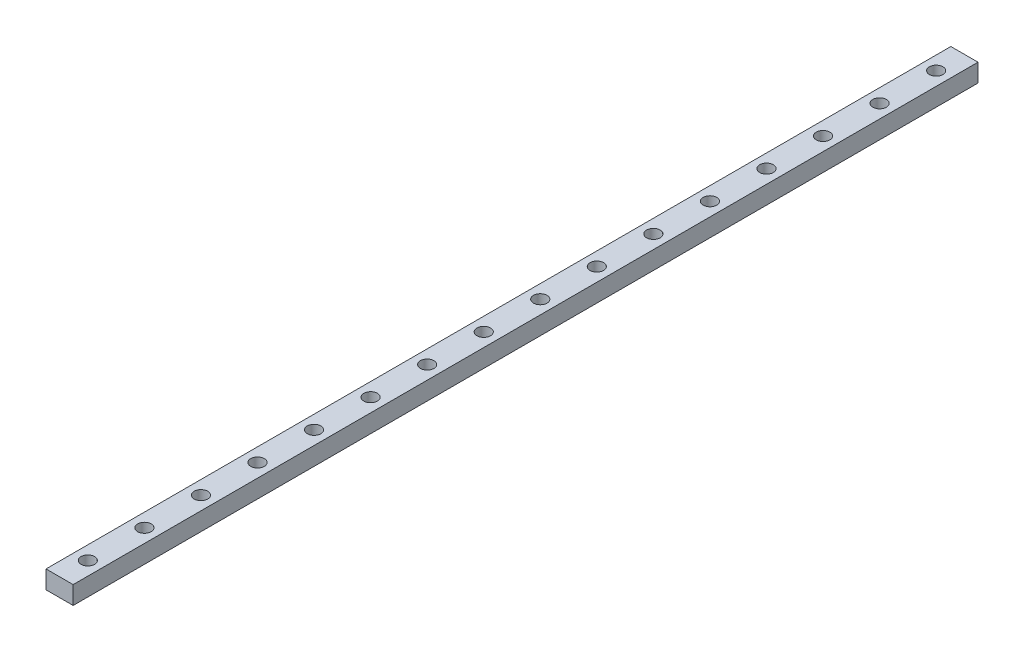
from build123d import *

# Parameters (mm, degrees)
SKETCH1_W           = 12
SKETCH1_H           = 8
BOSS_EXTRUDE1_DEPTH = 400
SKETCH2_R           = 3
CUT_EXTRUDE1_DEPTH  = 4.5
SKETCH4_R           = 1.75
CUT_EXTRUDE2_DEPTH  = 401.259915555
LPATTERN2_COUNT     = 16
LPATTERN2_PITCH     = 25


with BuildPart() as part:
    # Sketch1 → Boss-Extrude1 (new body)
    with BuildSketch(Plane.XY):
        with Locations((6, 4)):
            Rectangle(SKETCH1_W, SKETCH1_H)
    extrude(amount=BOSS_EXTRUDE1_DEPTH)

    # Sketch2 → Cut-Extrude1 (cut)
    with BuildSketch(Plane(origin=(0, 8, 0), x_dir=(1, 0, 0), z_dir=(0, 1, 0))):
        with Locations(Location((6, -12.5, 0), (0, 0, 270))):
            Circle(SKETCH2_R)
    cut_extrude1 = extrude(amount=-CUT_EXTRUDE1_DEPTH, mode=Mode.SUBTRACT)

    # Sketch4 → Cut-Extrude2 (cut, through all)
    with BuildSketch(Plane.XZ):
        with Locations(Location((6, 12.5, 0), (0, 0, 270))):
            Circle(SKETCH4_R)
    cut_extrude2 = extrude(amount=-CUT_EXTRUDE2_DEPTH, mode=Mode.SUBTRACT)

    # LPattern2: Cut-Extrude1, Cut-Extrude2 ×16
    with Locations(*[(0, 0, i * LPATTERN2_PITCH) for i in range(1, LPATTERN2_COUNT)]):
        add(cut_extrude1, mode=Mode.SUBTRACT)
        add(cut_extrude2, mode=Mode.SUBTRACT)


solid = part.part
